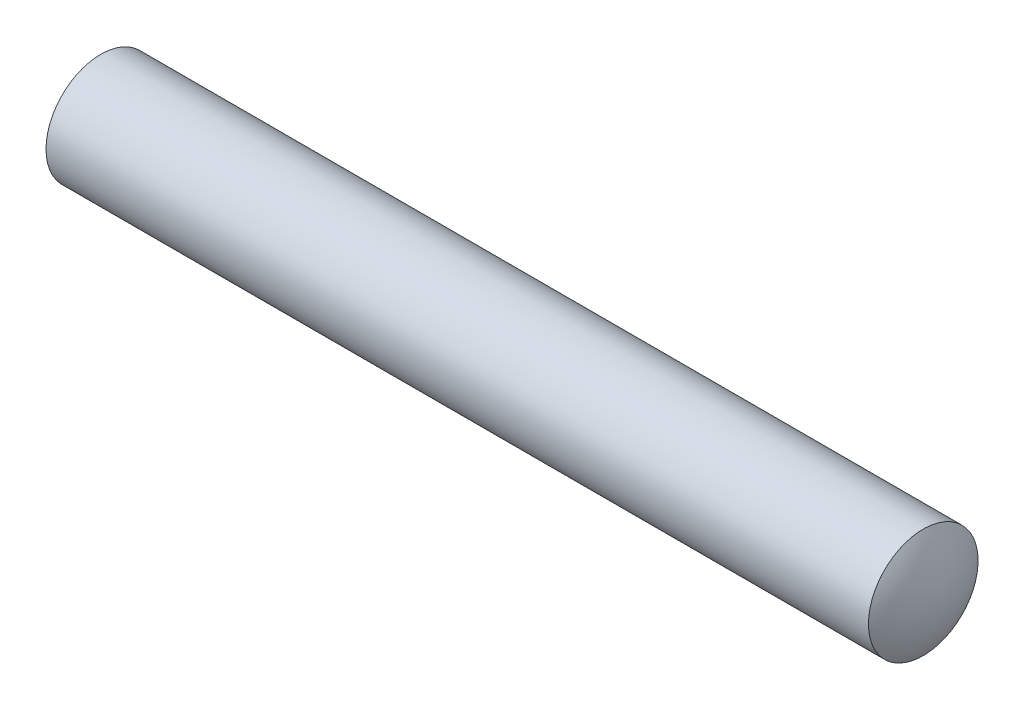
from build123d import *


with BuildPart() as part:
    # Эскиз1 → Повернуть2 (revolve)
    with BuildSketch(Plane.XY, mode=Mode.PRIVATE) as revolve_2_sk:
        with BuildLine():
            Line((0, 2), (30, 2))
            ThreePointArc((30, 2), (30.432805569, 1.039841671), (30.6, 0))
            Line((30.6, 0), (-0.6, 0))
            ThreePointArc((-0.6, 0), (-0.432805569, 1.039841671), (0, 2))
        make_face()
    revolve(revolve_2_sk.sketch.rotate(Axis((0, 0, 0), (1, 0, 0)), 90), axis=Axis((0, 0, 0), (1, 0, 0)))


solid = part.part
